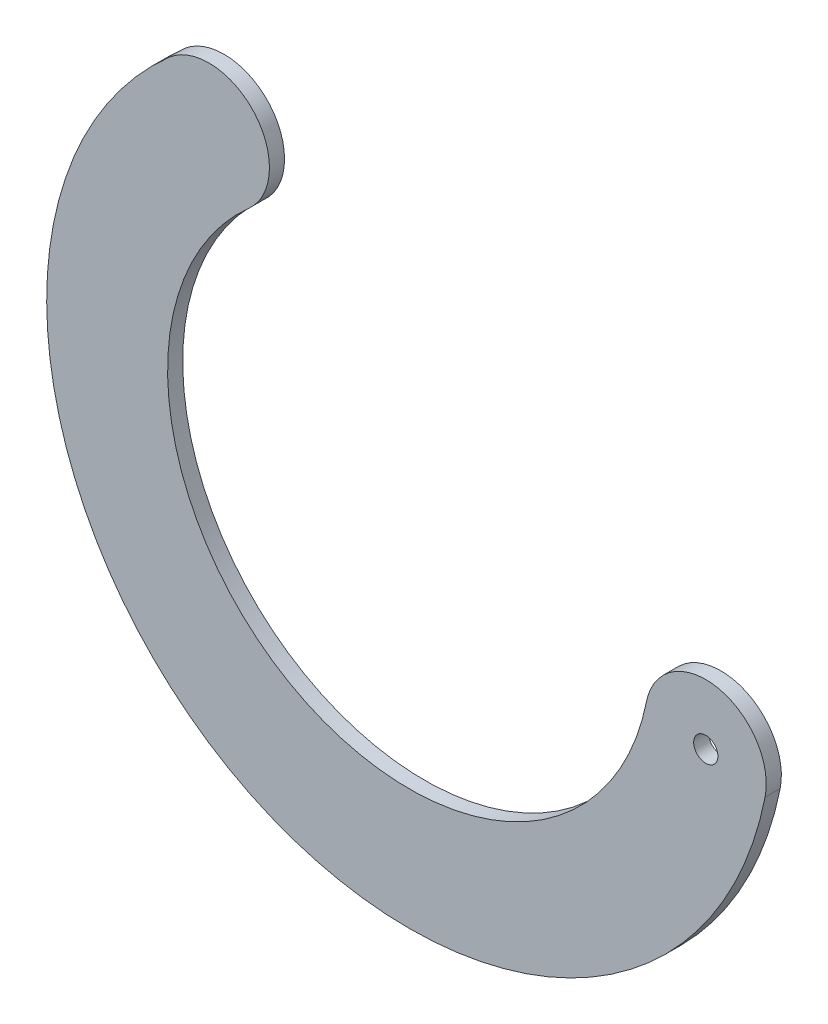
from build123d import *

# Parameters (mm, degrees)
BOSS_EXTRUDE1_DEPTH     = 3.175
F_1_4_20_TAPPED_HOLE1_D = 5.1054


with BuildPart() as part:
    # Sketch1 → Boss-Extrude1 (new body)
    with BuildSketch(Plane.XY):
        with BuildLine():
            ThreePointArc((-50.528450834, 57.037844072), (-37.969184963, -66.066489185), (74.720247488, -14.944049498))
            ThreePointArc((74.720247488, -14.944049498), (64.757547823, 0), (49.813498325, -9.962699665))
            ThreePointArc((49.813498325, -9.962699665), (-25.312789976, -44.044326123), (-33.685633889, 38.025229381))
            ThreePointArc((-33.685633889, 38.025229381), (-32.600735016, 55.952945199), (-50.528450834, 57.037844072))
        make_face()
    extrude(amount=BOSS_EXTRUDE1_DEPTH)

    # 1/4-20 Tapped Hole1 (through all)
    with Locations(Plane.XY.offset(3.175)):
        with Locations((62.266872906, -12.453374581)):
            Hole(F_1_4_20_TAPPED_HOLE1_D / 2)


solid = part.part
